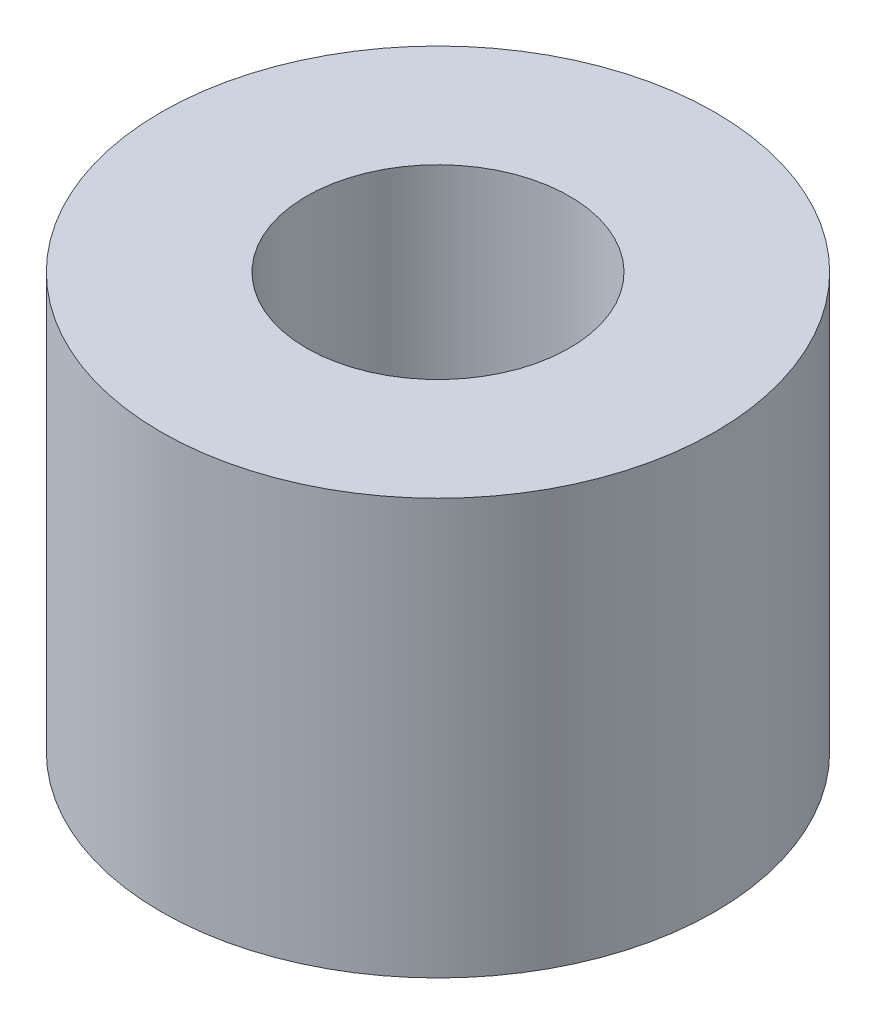
from build123d import *

# Parameters (mm, degrees)
ESBO_O1_R                = 2
ESBO_O1_R_2              = 0.95
RESSALTO_EXTRUS_O1_DEPTH = 3


with BuildPart() as part:
    # Esboço1 → Ressalto-extrusão1 (new body)
    with BuildSketch(Plane(origin=(0, 0, 0), x_dir=(1, 0, 0), z_dir=(0, 1, 0))):
        with Locations(Location((0, 0, 0), (0, 0, 270))):
            Circle(ESBO_O1_R)
        with Locations(Location((0, 0, 0), (0, 0, 270))):
            Circle(ESBO_O1_R_2, mode=Mode.SUBTRACT)
    extrude(amount=RESSALTO_EXTRUS_O1_DEPTH)


solid = part.part
